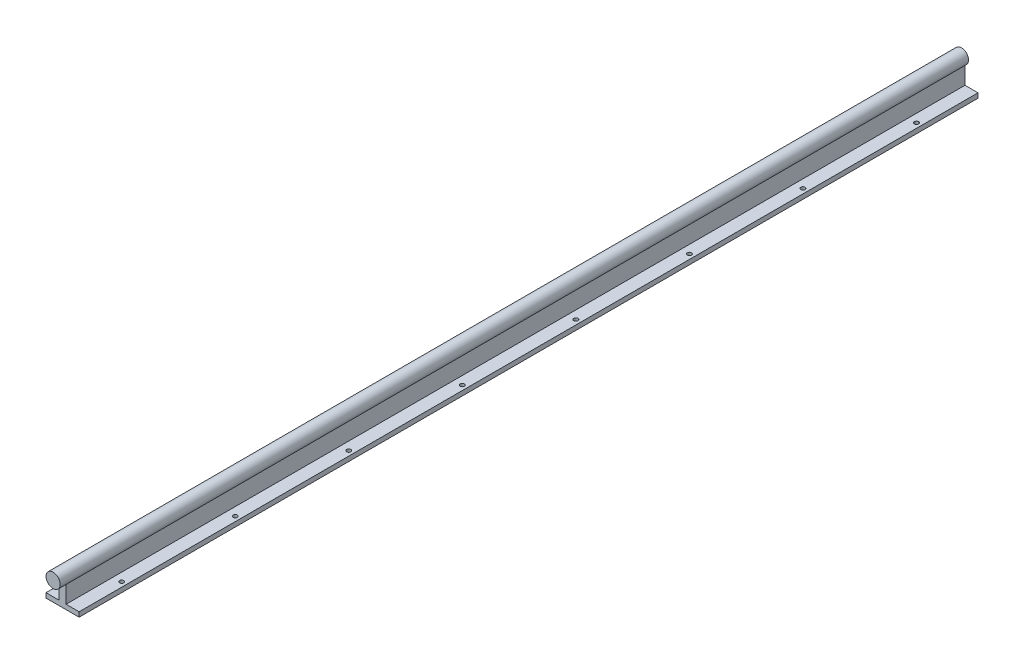
from build123d import *

# Parameters (mm, degrees)
EXTRUDE1_DEPTH         = 1219.2
F_10_CLEARANCE_HOLE1_D = 5.6134
LPATTERN3_COUNT        = 8
LPATTERN3_PITCH        = 152.4
SKETCH4_OUTSIDE_W      = 290.638
SKETCH4_OUTSIDE_H      = 293.813
SKETCH4_OUTSIDE_R      = 9.525
CUT_EXTRUDE1_DEPTH     = 12.7


with BuildPart() as part:
    # Sketch1 → Extrude1 (new body)
    with BuildSketch(Plane.XY):
        with BuildLine():
            Line((-22.225, -38.1), (22.225, -38.1))
            Line((22.225, -38.1), (22.225, -31.75))
            Line((22.225, -31.75), (4.7625, -31.75))
            Line((4.7625, -31.75), (4.7625, -8.248891971))
            ThreePointArc((4.7625, -8.248891971), (0, 9.525), (-4.7625, -8.248891971))
            Line((-4.7625, -8.248891971), (-4.7625, -31.75))
            Line((-4.7625, -31.75), (-22.225, -31.75))
            Line((-22.225, -31.75), (-22.225, -38.1))
        make_face()
    extrude(amount=EXTRUDE1_DEPTH)

    # #10 Clearance Hole1 (through all)
    with Locations(Plane.XZ.offset(38.1)):
        with Locations((-15.875, 76.2), (15.875, 76.2)):
            f_10_clearance_hole1 = Hole(F_10_CLEARANCE_HOLE1_D / 2)

    # LPattern3: #10 Clearance Hole1 ×8
    with Locations(*[(0, 0, i * LPATTERN3_PITCH) for i in range(1, LPATTERN3_COUNT)]):
        add(f_10_clearance_hole1, mode=Mode.SUBTRACT)

    # Sketch4 outside → Cut-Extrude1 (cut)
    with BuildSketch(Plane.XY.offset(1219.2)):
        with Locations((0, -14.2875)):
            Rectangle(SKETCH4_OUTSIDE_W, SKETCH4_OUTSIDE_H)
        with Locations(Location((0, 0, 0), (0, 0, 240))):
            Circle(SKETCH4_OUTSIDE_R, mode=Mode.SUBTRACT)
    extrude(amount=-CUT_EXTRUDE1_DEPTH, mode=Mode.SUBTRACT)


solid = part.part
